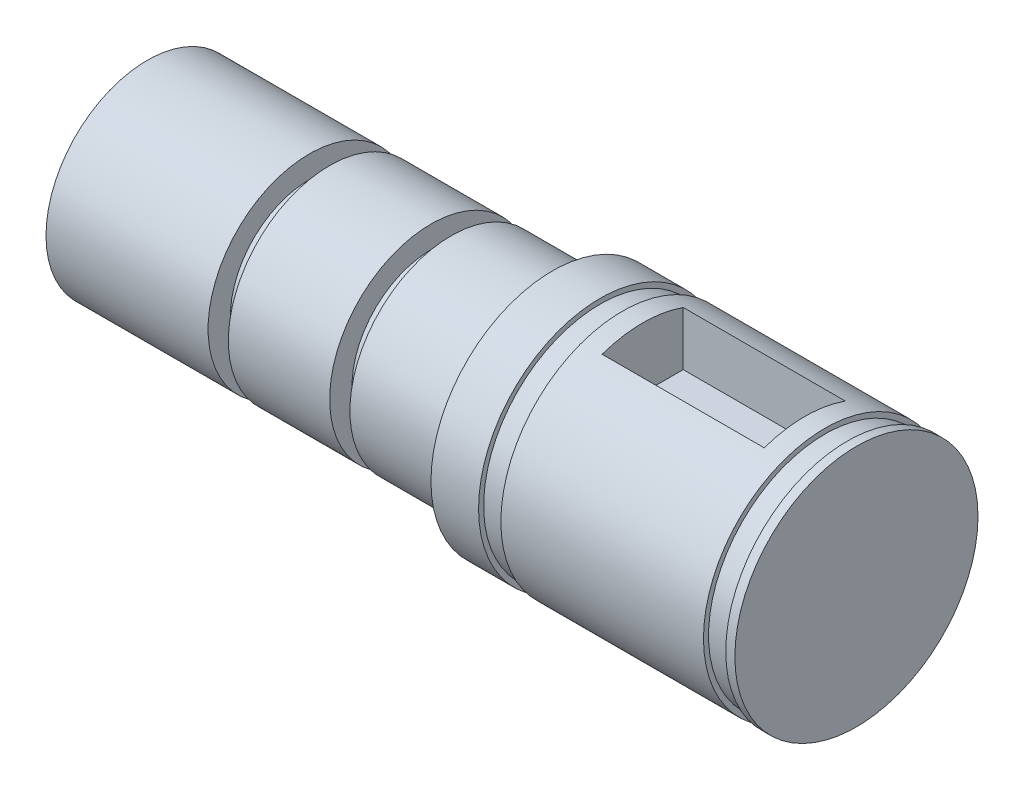
from build123d import *

# Parameters (mm, degrees)
SKETCH1_R           = 6
BOSS_EXTRUDE1_DEPTH = 15
SKETCH2_R           = 5
BOSS_EXTRUDE2_DEPTH = 20
SKETCH3_W           = 8
SKETCH3_H           = 4
CUT_EXTRUDE1_DEPTH  = 3
SKETCH4_W           = 1
SKETCH4_H           = 1.1
SKETCH4_W_2         = 1.1
SKETCH4_H_2         = 0.25


with BuildPart() as part:
    # Sketch1 → Boss-Extrude1 (new body)
    with BuildSketch(Plane(origin=(0, 0, 0), x_dir=(0, 0, -1), z_dir=(1, 0, 0))):
        Circle(SKETCH1_R)
    extrude(amount=BOSS_EXTRUDE1_DEPTH)

    # Sketch2 → Boss-Extrude2 (add)
    with BuildSketch(Plane.ZY):
        Circle(SKETCH2_R)
    extrude(amount=BOSS_EXTRUDE2_DEPTH)

    # Sketch3 → Cut-Extrude1 (cut)
    with BuildSketch(Plane(origin=(0, 6, 0), x_dir=(1, 0, 0), z_dir=(0, 1, 0))):
        with Locations((8.45, 0)):
            Rectangle(SKETCH3_W, SKETCH3_H)
    extrude(amount=-CUT_EXTRUDE1_DEPTH, mode=Mode.SUBTRACT)

    # Sketch4 → Cut-Revolve1 (revolve, cut)
    with BuildSketch(Plane.XY, mode=Mode.PRIVATE) as cut_revolve1_sk:
        with Locations((-5.5, 4.45)):
            Rectangle(SKETCH4_W, SKETCH4_H)
        with Locations((-11.5, 4.45)):
            Rectangle(SKETCH4_W, SKETCH4_H)
        with Locations((2.9, 5.875)):
            Rectangle(SKETCH4_W_2, SKETCH4_H_2)
        with Locations((14, 5.875)):
            Rectangle(SKETCH4_W_2, SKETCH4_H_2)
    revolve(cut_revolve1_sk.sketch.rotate(Axis((0, 0, 0), (-1, 0, 0)), 90), axis=Axis((0, 0, 0), (-1, 0, 0)), mode=Mode.SUBTRACT)


solid = part.part
